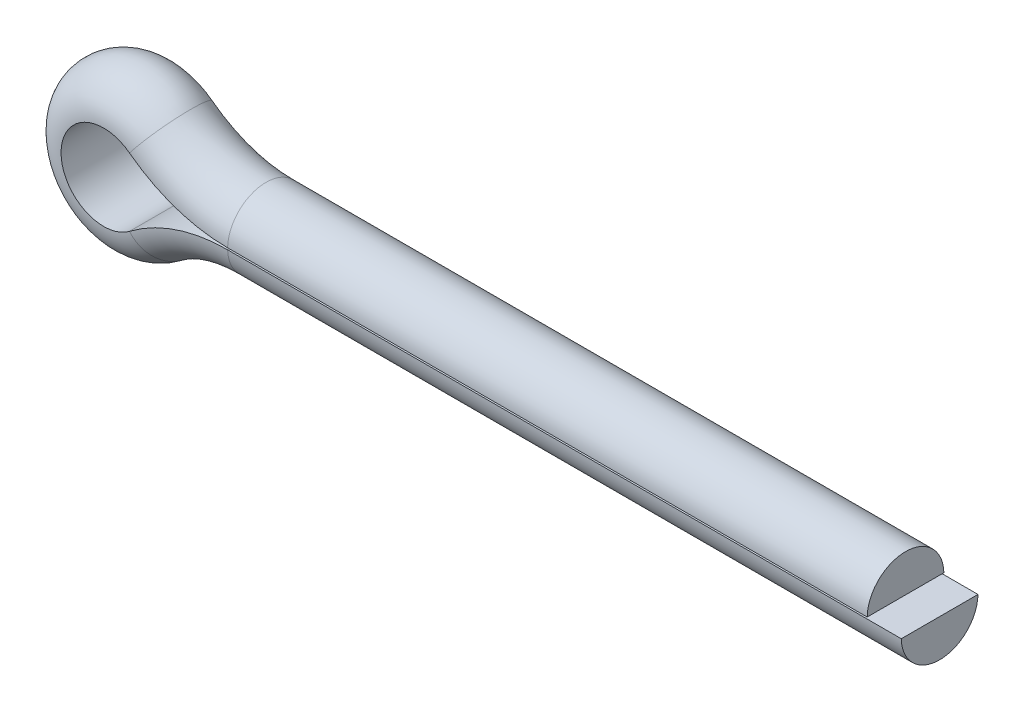
from build123d import *


with BuildPart() as part:
    # Sweep1: sweep along a path in Sketch3
    with BuildLine(Plane.XY) as sweep1_path:
        Line((0, 0.0254), (-19.05, 0.0254))
        ThreePointArc((-19.05, 0.0254), (-20.591930286, 0.278356485), (-21.972218938, 1.010708333))
        ThreePointArc((-21.972218938, 1.010708333), (-24.011223922, 0), (-21.972218938, -1.010708333))
        ThreePointArc((-21.972218938, -1.010708333), (-20.591930286, -0.278356485), (-19.05, -0.0254))
        Line((-19.05, -0.0254), (1.016, -0.0254))
    # Sketch4 → Sweep1 (sweep)
    with BuildSketch(Plane(origin=(0, 0, 0), x_dir=(0, 0, -1), z_dir=(1, 0, 0))):
        with BuildLine():
            Line((-1.142717743, 0.0254), (1.142717743, 0.0254))
            ThreePointArc((1.142717743, 0.0254), (0, 1.143), (-1.142717743, 0.0254))
        make_face()
    sweep(path=sweep1_path.line)


solid = part.part
